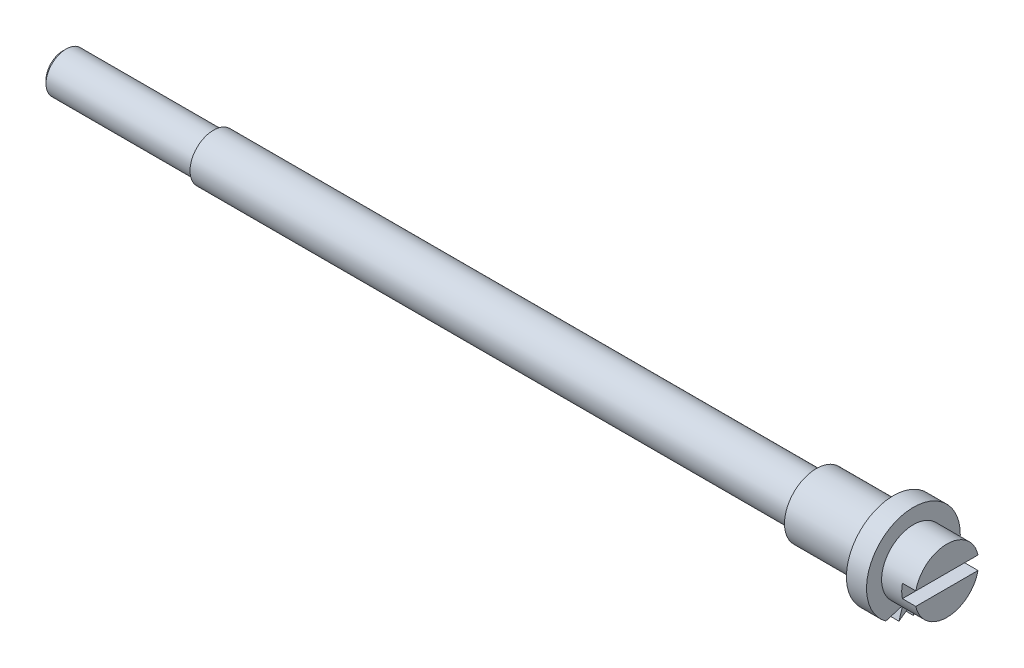
from build123d import *

# Parameters (mm, degrees)
CHAMFER_1_SIZE           = 1
SKETCH_2_W               = 19
SKETCH_2_H               = 4
CUT_EXTRUDE_1_DEPTH      = 4
CUT_EXTRUDE_3_DEPTH      = 255.770484947
PATTERN_CIRCULAR_1_COUNT = 2
PATTERN_CIRCULAR_1_ANGLE = 18
F_1_THE_OTHER_WAY_COUNT  = 2
F_1_THE_OTHER_WAY_ANGLE  = 18


with BuildPart() as part:
    # 草图1 → 旋转1 (revolve)
    with BuildSketch(Plane.XY, mode=Mode.PRIVATE) as revolve_1_sk:
        Polygon((-264, 0), (-264, 6), (-219, 6), (-219, 7), (-39, 7), (-39, 9.5), (-16, 9.5), (-16, 14), (-10, 14), (-10, 9.5), (0, 9.5), (0, 0), align=None)
    revolve(revolve_1_sk.sketch.rotate(Axis((0, 0, 0), (-1, 0, 0)), 90), axis=Axis((0, 0, 0), (-1, 0, 0)))

    # 倒角1
    chamfer_1_edges = [part.edges().sort_by_distance(p)[0] for p in [
        (-264, 0, 6),
    ]]
    chamfer(chamfer_1_edges, length=CHAMFER_1_SIZE)

    # 草图2 → 切除-拉伸-薄壁1 (cut)
    with BuildSketch(Plane(origin=(0, 0, 0), x_dir=(0, 0, -1), z_dir=(1, 0, 0))):
        Rectangle(SKETCH_2_W, SKETCH_2_H)
    extrude(amount=-CUT_EXTRUDE_1_DEPTH, mode=Mode.SUBTRACT)

    # 草图4 → 切除-拉伸3 (cut, symmetric)
    with BuildSketch(Plane(origin=(-10, 0, 0), x_dir=(0, 0, -1), z_dir=(1, 0, 0))):
        Polygon((0, -89.785980761), (0, -14), (0, -10.3), (-4.326237921, -13.314791228), (-66.504055872, -56.644155807), (-134.109197976, -192.304040375), (-67.605142103, -225.445865329), align=None)
    cut_extrude_3 = extrude(amount=CUT_EXTRUDE_3_DEPTH, both=True, mode=Mode.SUBTRACT)

    # 阵列(圆周)1: 切除-拉伸3 ×2 about axis
    pattern_circular_1_axis = Axis((0, 0, 0), (1, 0, 0))
    for i in range(1, PATTERN_CIRCULAR_1_COUNT):
        add(cut_extrude_3.rotate(pattern_circular_1_axis, i * PATTERN_CIRCULAR_1_ANGLE / (PATTERN_CIRCULAR_1_COUNT - 1)), mode=Mode.SUBTRACT)

    # 1 the other way: 切除-拉伸3 ×2 about axis
    f_1_the_other_way_axis = Axis((0, 0, 0), (-1, 0, 0))
    for i in range(1, F_1_THE_OTHER_WAY_COUNT):
        add(cut_extrude_3.rotate(f_1_the_other_way_axis, i * F_1_THE_OTHER_WAY_ANGLE / (F_1_THE_OTHER_WAY_COUNT - 1)), mode=Mode.SUBTRACT)


solid = part.part
